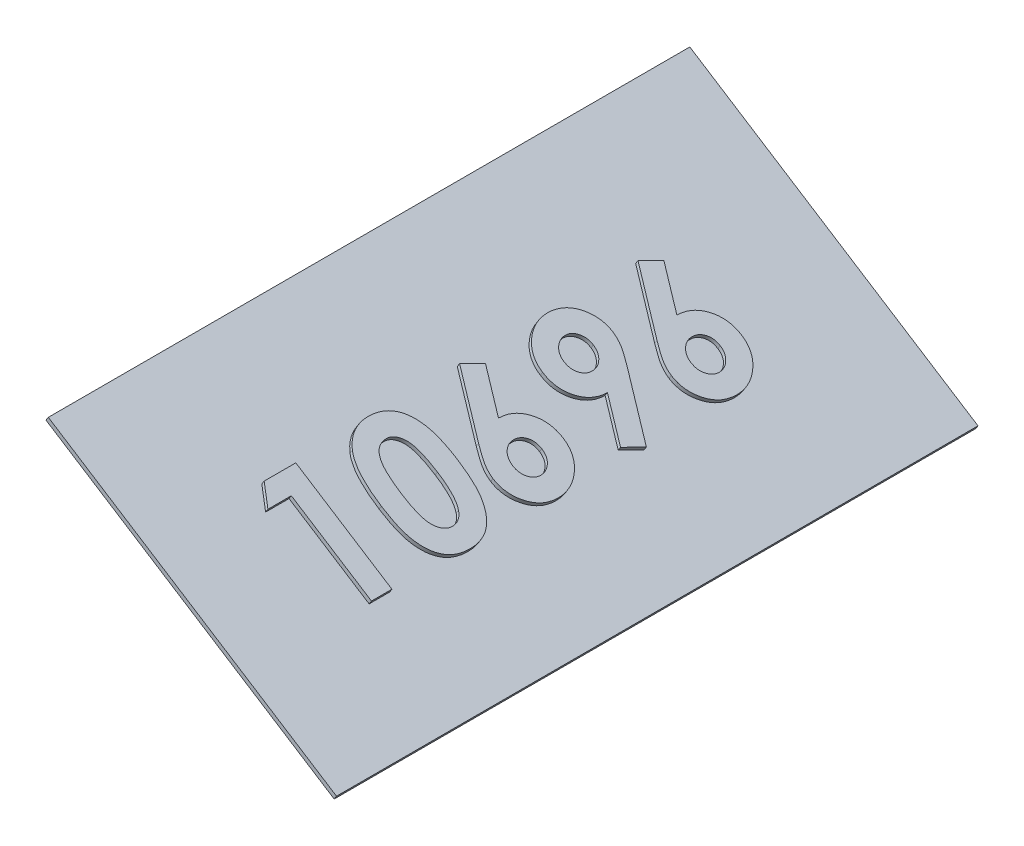
from build123d import *

# Parameters (mm, degrees)
EXTRUDE_THIN1_DEPTH = 372
BOSS_EXTRUDE1_DEPTH = 2.5


with BuildPart() as part:
    # Sketch1 → Extrude-Thin1 (new body)
    with BuildSketch(Plane.XY):
        Polygon((-701.811312748, 261.58386132), (-534.692998821, 154.86512132), (-536.038512725, 152.758087307), (-703.156826652, 259.476827307), align=None)
    extrude(amount=EXTRUDE_THIN1_DEPTH)

    # Sketch3 → Boss-Extrude1 (add)
    # profile 1 of 5: a face of its own
    with BuildSketch(Plane(origin=(-84.634070268, -132.534390154, 0), x_dir=(0.8428136053453406, -0.5382055616999779, 0), z_dir=(0.5382055616999778, 0.8428136053453404, 0))):
        Polygon((-663.215230738, -306.397431724), (-663.215230738, -288.045673077), (-597.069397405, -288.045673077), (-597.069397405, -299.918002137), (-652.190925183, -299.918002137), (-652.190925183, -313.486378205), align=None)
    # profile 2 of 5: a face of its own
    with BuildSketch(Plane(origin=(-84.634070268, -132.534390154, 0), x_dir=(0.8428136053453406, -0.5382055616999779, 0), z_dir=(0.5382055616999778, 0.8428136053453404, 0))):
        with BuildLine():
            add(Edge.make_bspline(
                [(-664.911277747, -244.571218116), (-664.902748365, -243.996547211), (-664.88597732, -242.866590672), (-664.70427082, -241.202392858), (-664.429892355, -239.599250826), (-664.046771665, -238.051169853), (-663.541371368, -236.56828686), (-662.931362489, -235.145414295), (-662.210987341, -233.78383582), (-661.376933891, -232.482109266), (-660.416323931, -231.251861537), (-659.357193197, -230.073201328), (-658.15860971, -228.993387853), (-656.851592315, -227.979792273), (-655.428326544, -227.039337076), (-653.89295764, -226.165948711), (-652.236009649, -225.368333503), (-650.455047475, -224.636978243), (-648.5232169, -223.983031552), (-646.418404739, -223.432203708), (-644.140116953, -222.959779465), (-641.682686494, -222.561019248), (-639.042845677, -222.259621199), (-636.222348628, -222.056472785), (-633.226632748, -221.917062746), (-631.171596273, -221.905685069), (-630.115813337, -221.899839744)],
                knots=[0, 0, 0, 0, 0.879187688, 1.728717895, 2.558878706, 3.367146394, 4.166631857, 4.95393622, 5.734098362, 6.521634849, 7.316678452, 8.120609651, 8.943639266, 9.781961388, 10.650008082, 11.55217958, 12.483362701, 13.462505087, 14.497127373, 15.602264045, 16.790140859, 18.057036744, 19.411188506, 20.855078804, 22.384284574, 24, 24, 24, 24], degree=3))
            add(Edge.make_bspline(
                [(-630.115813337, -221.899839744), (-629.046821661, -221.906158), (-626.969790011, -221.91843426), (-623.946669811, -222.050666324), (-621.105708074, -222.278449982), (-618.447119957, -222.571802406), (-615.972576357, -222.974411837), (-613.67894631, -223.442487896), (-611.565796799, -224.007025861), (-609.632955079, -224.678741581), (-607.847153607, -225.411222638), (-606.186864008, -226.198327844), (-604.66440446, -227.074191015), (-603.231557041, -227.958988463), (-601.950962067, -228.951447954), (-600.7722328, -229.978080032), (-599.740479912, -231.091059655), (-598.801715226, -232.242221704), (-597.99047251, -233.474077601), (-597.28096274, -234.773835472), (-596.705468674, -236.1646913), (-596.204933913, -237.621285788), (-595.845604146, -239.168448646), (-595.56048773, -240.781595182), (-595.402914922, -242.478937631), (-595.383366977, -243.63455673), (-595.373350397, -244.226708567)],
                knots=[0, 0, 0, 0, 1.643824397, 3.193921316, 4.652018541, 6.026147715, 7.305813021, 8.506024873, 9.624771103, 10.66654028, 11.650369642, 12.592128821, 13.489360096, 14.35046321, 15.179132238, 15.977837183, 16.751455772, 17.509897991, 18.259653136, 19.016390304, 19.783391144, 20.571659993, 21.382176161, 22.223003704, 23.089447706, 24, 24, 24, 24], degree=3))
            add(Edge.make_bspline(
                [(-595.373350397, -244.226708567), (-595.383562209, -244.818843354), (-595.403567, -245.978826693), (-595.559293698, -247.680773931), (-595.846838882, -249.302415338), (-596.207406269, -250.862012252), (-596.705400605, -252.347569092), (-597.294078827, -253.772273403), (-598.018027657, -255.107952826), (-598.827671296, -256.382129105), (-599.760737791, -257.574678503), (-600.802566415, -258.703279041), (-601.938553368, -259.783717676), (-603.208172035, -260.777501823), (-604.588230511, -261.702405932), (-606.07853759, -262.568245607), (-607.683964746, -263.357433788), (-609.404078022, -264.096363488), (-611.280151242, -264.750111228), (-613.329825115, -265.313842287), (-615.56844942, -265.791327016), (-617.99378394, -266.166606869), (-620.606151299, -266.469236655), (-623.403455494, -266.693661005), (-626.386729513, -266.826699048), (-628.43729374, -266.838836426), (-629.493046076, -266.84508547)],
                knots=[0, 0, 0, 0, 0.917318694, 1.797013832, 2.644089644, 3.467281984, 4.274391433, 5.068665368, 5.852346333, 6.624865025, 7.405043053, 8.194438745, 9.002823433, 9.831034161, 10.688848002, 11.574933485, 12.499091769, 13.45866927, 14.473616003, 15.574277631, 16.749933499, 18.017757418, 19.374908438, 20.82337846, 22.364486432, 24, 24, 24, 24], degree=3))
            add(Edge.make_bspline(
                [(-629.493046076, -266.84508547), (-630.959929438, -266.83375832), (-633.79029978, -266.811902439), (-637.879361997, -266.534928662), (-641.658991687, -266.128401405), (-645.122866462, -265.531309164), (-648.283815504, -264.793012865), (-651.121016135, -263.84758601), (-653.67372739, -262.771286311), (-655.185968905, -261.854140693), (-655.914278381, -261.412434896)],
                knots=[0, 0, 0, 0, 1.288568992, 2.486310467, 3.599230591, 4.627010532, 5.572937695, 6.447898582, 7.252493626, 8, 8, 8, 8], degree=3))
            add(Edge.make_bspline(
                [(-655.914278381, -261.412434896), (-656.629769384, -260.898840434), (-658.02869528, -259.894662057), (-659.865223488, -258.138828097), (-661.435912343, -256.252413112), (-662.705215749, -254.196671216), (-663.706188518, -252.004114822), (-664.413164312, -249.655919719), (-664.825081352, -247.160757398), (-664.882116556, -245.447287811), (-664.911277747, -244.571218116)],
                knots=[0, 0, 0, 0, 1.058512271, 2.069600068, 3.047294572, 4.004278952, 4.967380941, 5.939006123, 6.946246673, 8, 8, 8, 8], degree=3))
        make_face()
        with BuildLine():
            add(Edge.make_bspline(
                [(-653.038948687, -244.279710036), (-653.014249712, -244.799163217), (-652.96582661, -245.817567195), (-652.557118328, -247.296234851), (-651.921068817, -248.684541461), (-651.174873535, -249.752303329), (-650.444456278, -250.542456916), (-649.784142299, -251.097117449), (-649.046726388, -251.631774856), (-648.199328649, -252.103447598), (-647.269926936, -252.553363571), (-646.255843965, -252.979464236), (-645.140563224, -253.345854546), (-643.931592925, -253.695298374), (-642.599661709, -253.997522814), (-641.131901913, -254.261967434), (-639.523302307, -254.487248474), (-637.767120409, -254.649725215), (-635.872558685, -254.798908095), (-633.831447329, -254.906324771), (-631.644215151, -254.951133866), (-630.137906044, -254.965396083), (-629.360542404, -254.97275641)],
                knots=[0, 0, 0, 0, 1.076486532, 2.110485037, 3.16053299, 4.233735637, 4.798028448, 5.389657808, 6.0205397, 6.6857231, 7.399126456, 8.163539924, 8.966557062, 9.834164971, 10.774831688, 11.799768806, 12.928987201, 14.14492726, 15.459726247, 16.873396567, 18.386448164, 20, 20, 20, 20], degree=3))
            add(Edge.make_bspline(
                [(-629.360542404, -254.97275641), (-628.353435204, -254.960612094), (-626.422232478, -254.937324467), (-623.6450072, -254.816166556), (-621.113463292, -254.570442601), (-618.817805056, -254.271981866), (-616.771416246, -253.840961519), (-614.956118506, -253.353190545), (-613.388196963, -252.747860941), (-612.048834327, -252.048625244), (-610.90945311, -251.274116156), (-609.940971173, -250.433369577), (-609.102312188, -249.554990144), (-608.42107967, -248.61156563), (-607.899014509, -247.605345568), (-607.523499476, -246.544730349), (-607.293631089, -245.429045889), (-607.261755733, -244.665036674), (-607.245679456, -244.279710036)],
                knots=[0, 0, 0, 0, 1.771738815, 3.39744054, 4.888007323, 6.245018868, 7.467093912, 8.564230264, 9.548241846, 10.417081984, 11.216594933, 11.965786359, 12.669352538, 13.348558586, 14.005353126, 14.656563323, 15.322440191, 16, 16, 16, 16], degree=3))
            add(Edge.make_bspline(
                [(-607.245679456, -244.279710036), (-607.256680039, -243.907606587), (-607.278217813, -243.179074302), (-607.499300164, -242.116711071), (-607.858732048, -241.112064912), (-608.367173683, -240.168169165), (-609.013735015, -239.281647645), (-609.801257309, -238.456833125), (-610.737590329, -237.69994619), (-611.432487908, -237.258980426), (-611.790555425, -237.031759148)],
                knots=[0, 0, 0, 0, 0.992283464, 1.942767638, 2.88273346, 3.832339453, 4.79467288, 5.803907806, 6.868395428, 8, 8, 8, 8], degree=3))
            add(Edge.make_bspline(
                [(-611.790555425, -237.031759148), (-612.279843242, -236.764244361), (-613.305840115, -236.203287548), (-615.037171582, -235.554147356), (-616.989827328, -235.007737322), (-619.169884202, -234.537450196), (-621.585940617, -234.21580249), (-624.222676151, -233.938799878), (-627.093368337, -233.805194634), (-629.08219424, -233.783463014), (-630.115813337, -233.772168803)],
                knots=[0, 0, 0, 0, 0.710965849, 1.490837728, 2.352621235, 3.297892224, 4.334225155, 5.461620853, 6.680770821, 8, 8, 8, 8], degree=3))
            add(Edge.make_bspline(
                [(-630.115813337, -233.772168803), (-631.158404747, -233.776531513), (-633.165215231, -233.784928984), (-636.046227758, -233.938998258), (-638.677554554, -234.153551494), (-641.053320937, -234.467380941), (-643.179294229, -234.871179565), (-645.055335451, -235.368862894), (-646.68514192, -235.955594517), (-648.067088495, -236.651388298), (-649.241553512, -237.422023143), (-650.249153397, -238.240075555), (-651.109416757, -239.109004594), (-651.825580915, -240.027357128), (-652.372784045, -241.016388745), (-652.759154723, -242.057207656), (-652.992896025, -243.151947615), (-653.023390602, -243.898715251), (-653.038948687, -244.279710036)],
                knots=[0, 0, 0, 0, 1.793836731, 3.452829483, 4.963243077, 6.335886805, 7.574563692, 8.684454726, 9.672768357, 10.54971625, 11.340229787, 12.085688095, 12.778991901, 13.440269426, 14.083255152, 14.715733572, 15.344777694, 16, 16, 16, 16], degree=3))
        make_face(mode=Mode.SUBTRACT)
    # profile 3 of 5: a face of its own
    with BuildSketch(Plane(origin=(-84.634070268, -132.534390154, 0), x_dir=(0.8428136053453406, -0.5382055616999779, 0), z_dir=(0.5382055616999778, 0.8428136053453404, 0))):
        with BuildLine():
            Line((-664.911277747, -191.636000935), (-659.584630111, -181.128459702))
            Line((-659.584630111, -181.128459702), (-636.926502106, -192.656279213))
            add(Edge.make_bspline(
                [(-636.926502106, -192.656279213), (-636.90899777, -191.975176517), (-636.874520111, -190.633633058), (-636.591979476, -188.660684582), (-636.113134296, -186.769719181), (-635.444879546, -184.960815043), (-634.605324979, -183.22105331), (-633.572098428, -181.558879745), (-632.320691201, -179.996426359), (-630.931644194, -178.504543729), (-629.393486626, -177.147703715), (-627.74050166, -175.969120708), (-626.01312721, -174.941987372), (-624.172659329, -174.143539864), (-622.249621218, -173.499484243), (-620.236321521, -173.034770089), (-618.126931298, -172.769637587), (-616.693926924, -172.733084656), (-615.96442111, -172.714476496)],
                knots=[0, 0, 0, 0, 1.013301021, 1.995862538, 2.958769729, 3.911210226, 4.860765807, 5.829243184, 6.816804824, 7.835209597, 8.859810738, 9.863084768, 10.852896952, 11.844649668, 12.842374562, 13.8676291, 14.914464604, 16, 16, 16, 16], degree=3))
            add(Edge.make_bspline(
                [(-615.96442111, -172.714476496), (-615.261241753, -172.731967151), (-613.871357701, -172.766538676), (-611.829625069, -173.050679424), (-609.867969891, -173.514879357), (-607.992186941, -174.163311913), (-606.202404631, -175.010381362), (-604.488867976, -176.028497823), (-602.864869656, -177.247088854), (-601.34051113, -178.628209633), (-599.95115564, -180.138294253), (-598.716187287, -181.729932903), (-597.696063487, -183.416700857), (-596.834543195, -185.166693602), (-596.191662868, -187.012135508), (-595.70639947, -188.925407883), (-595.42638145, -190.921020046), (-595.391168864, -192.275590436), (-595.373350397, -192.96103766)],
                knots=[0, 0, 0, 0, 1.049918105, 2.075237872, 3.072085611, 4.056810501, 5.033614955, 6.024683311, 7.028730171, 8.060902963, 9.092654048, 10.090156417, 11.064284078, 12.032024683, 12.998077465, 13.977262554, 14.976443176, 16, 16, 16, 16], degree=3))
            add(Edge.make_bspline(
                [(-595.373350397, -192.96103766), (-595.388103339, -193.677756426), (-595.417113004, -195.087086903), (-595.737221054, -197.150158647), (-596.228329814, -199.124017644), (-596.895339909, -201.016705412), (-597.800669146, -202.804646068), (-598.885498671, -204.503098309), (-600.174824684, -206.105278324), (-601.630039316, -207.600747804), (-603.224713251, -208.947779991), (-604.880224736, -210.149292693), (-606.599385668, -211.165756005), (-608.380302709, -211.988563851), (-610.217315176, -212.630536472), (-612.113905818, -213.077218759), (-614.065044922, -213.368273422), (-615.389198293, -213.402392946), (-616.057173681, -213.419604701)],
                knots=[0, 0, 0, 0, 1.063729824, 2.091680771, 3.092458079, 4.082252707, 5.065066109, 6.062289472, 7.070414589, 8.114214813, 9.156632944, 10.167081891, 11.149282074, 12.117871028, 13.076366051, 14.034232288, 15.008359245, 16, 16, 16, 16], degree=3))
            add(Edge.make_bspline(
                [(-616.057173681, -213.419604701), (-616.574442614, -213.410510672), (-617.611859813, -213.392271994), (-619.165333229, -213.208972752), (-620.722894391, -212.930319953), (-622.037181339, -212.607241476), (-623.148628598, -212.274770121), (-624.088946589, -211.939469834), (-625.129935017, -211.528446602), (-626.275374613, -211.044065964), (-627.534288882, -210.506416998), (-628.891914481, -209.881409526), (-630.359080104, -209.189397351), (-631.366445645, -208.695056953), (-631.891362549, -208.437466613)],
                knots=[0, 0, 0, 0, 1.110459156, 2.227099586, 3.354645278, 4.50724841, 5.131424341, 5.845429508, 6.650417918, 7.534765369, 8.5162346, 9.590157747, 10.744282107, 12, 12, 12, 12], degree=3))
            Line((-631.891362549, -208.437466613), (-664.911277747, -191.636000935))
        make_face()
        with BuildLine():
            add(Edge.make_bspline(
                [(-625.90219655, -193.226045005), (-625.876013986, -193.795668246), (-625.824778144, -194.910346155), (-625.29004875, -196.496052943), (-624.448641238, -197.936093567), (-623.292997455, -199.197386112), (-621.89148727, -200.244585931), (-620.289764156, -201.00815913), (-618.516877971, -201.474853465), (-617.279142214, -201.522618203), (-616.64018984, -201.547275641)],
                knots=[0, 0, 0, 0, 0.981531227, 1.92072777, 2.858278205, 3.847411092, 4.856727683, 5.864107753, 6.897395173, 8, 8, 8, 8], degree=3))
            add(Edge.make_bspline(
                [(-616.64018984, -201.547275641), (-616.001177591, -201.517683132), (-614.758256052, -201.460123724), (-612.974150192, -200.983084778), (-611.350363618, -200.189741717), (-609.937140439, -199.085711149), (-608.746932153, -197.798752926), (-607.878610837, -196.357109377), (-607.343652683, -194.804069752), (-607.278562701, -193.729276113), (-607.245679456, -193.186293904)],
                knots=[0, 0, 0, 0, 1.098517379, 2.136689732, 3.153260427, 4.188757218, 5.205896274, 6.153740673, 7.067275863, 8, 8, 8, 8], degree=3))
            add(Edge.make_bspline(
                [(-607.245679456, -193.186293904), (-607.279198621, -192.612891015), (-607.344935525, -191.48834836), (-607.856683492, -189.866072312), (-608.71182382, -188.384312368), (-609.883675991, -187.073368435), (-611.282113574, -185.952788674), (-612.918048083, -185.1635959), (-614.721057966, -184.669081823), (-615.987592356, -184.614783458), (-616.64018984, -184.586805556)],
                knots=[0, 0, 0, 0, 0.969156912, 1.90068503, 2.84824055, 3.843957741, 4.860802806, 5.860356532, 6.897522282, 8, 8, 8, 8], degree=3))
            add(Edge.make_bspline(
                [(-616.64018984, -184.586805556), (-617.278774031, -184.61767651), (-618.51546688, -184.677461719), (-620.296560452, -185.132809619), (-621.892298561, -185.932980924), (-623.298859512, -187.004025487), (-624.453729459, -188.3083657), (-625.29671346, -189.806231453), (-625.823817718, -191.464368591), (-625.87568935, -192.630257748), (-625.90219655, -193.226045005)],
                knots=[0, 0, 0, 0, 1.082993585, 2.097343529, 3.092828129, 4.092676255, 5.080456977, 6.026823306, 6.991676418, 8, 8, 8, 8], degree=3))
        make_face(mode=Mode.SUBTRACT)
    # profile 4 of 5: a face of its own
    with BuildSketch(Plane(origin=(-84.634070268, -132.534390154, 0), x_dir=(0.8428136053453406, -0.5382055616999779, 0), z_dir=(0.5382055616999778, 0.8428136053453404, 0))):
        with BuildLine():
            Line((-595.373350397, -141.920622997), (-600.673497298, -152.441414597))
            Line((-600.673497298, -152.441414597), (-623.358126038, -140.913595085))
            add(Edge.make_bspline(
                [(-623.358126038, -140.913595085), (-623.37548743, -141.594684083), (-623.409572042, -142.931826573), (-623.692774765, -144.900682428), (-624.176321053, -146.783382704), (-624.819695733, -148.60244618), (-625.683505021, -150.331498892), (-626.711055896, -151.99846075), (-627.964478975, -153.559806104), (-629.352331505, -155.052928325), (-630.890491505, -156.403571772), (-632.533987495, -157.5964159), (-634.267001205, -158.606469121), (-636.101178172, -159.417297368), (-638.018239327, -160.054125328), (-640.025704803, -160.523820639), (-642.131296179, -160.786609451), (-643.564234242, -160.823412133), (-644.293706299, -160.842147436)],
                knots=[0, 0, 0, 0, 1.014438208, 1.991587644, 2.955575466, 3.906834206, 4.860343588, 5.829907848, 6.818577787, 7.838125475, 8.863876483, 9.862937823, 10.859547262, 11.846397878, 12.845242478, 13.865236027, 14.913246352, 16, 16, 16, 16], degree=3))
            add(Edge.make_bspline(
                [(-644.293706299, -160.842147436), (-645.001305049, -160.824804666), (-646.395613745, -160.790631095), (-648.441844547, -160.506255589), (-650.407143422, -160.039637068), (-652.292051584, -159.393309327), (-654.086971132, -158.551644574), (-655.802597177, -157.534752453), (-657.432367657, -156.327485019), (-658.9550435, -154.939754221), (-660.354465452, -153.436172952), (-661.558898488, -151.818591468), (-662.610130798, -150.149245766), (-663.440687741, -148.382216426), (-664.115728289, -146.55033197), (-664.572193075, -144.628401818), (-664.859850884, -142.636061704), (-664.893998288, -141.281187323), (-664.911277747, -140.595586271)],
                knots=[0, 0, 0, 0, 1.055350394, 2.079546115, 3.075301024, 4.065173222, 5.046874257, 6.027823047, 7.036058964, 8.067100199, 9.097720188, 10.095392023, 11.071904115, 12.035727154, 13.002945728, 13.979480054, 14.977565287, 16, 16, 16, 16], degree=3))
            add(Edge.make_bspline(
                [(-664.911277747, -140.595586271), (-664.896518859, -139.878871294), (-664.867497503, -138.469548265), (-664.547474131, -136.406422572), (-664.056055189, -134.432761198), (-663.390183068, -132.539348401), (-662.481702676, -130.756220903), (-661.414455014, -129.049402747), (-660.122058894, -127.45197296), (-658.668093448, -125.95574153), (-657.073158732, -124.608746938), (-655.417444521, -123.407825055), (-653.695849381, -122.387002865), (-651.907174437, -121.57157219), (-650.063709847, -120.92319535), (-648.161377536, -120.481406183), (-646.202047458, -120.187329313), (-644.873389216, -120.153925128), (-644.200953729, -120.137019231)],
                knots=[0, 0, 0, 0, 1.062709067, 2.08967359, 3.089490552, 4.078335371, 5.060205664, 6.052952122, 7.060109841, 8.102908433, 9.144326257, 10.153805576, 11.135063239, 12.108674621, 13.066249871, 14.029571809, 15.002763993, 16, 16, 16, 16], degree=3))
            add(Edge.make_bspline(
                [(-644.200953729, -120.137019231), (-643.688114622, -120.14630423), (-642.655141357, -120.165006306), (-641.110302534, -120.34660387), (-639.561494442, -120.625919303), (-638.256917581, -120.951663303), (-637.152779021, -121.279318939), (-636.21875773, -121.620026027), (-635.17796124, -122.030934721), (-634.028787822, -122.506538122), (-632.77693036, -123.050657312), (-631.426739356, -123.681839323), (-629.957525588, -124.360218438), (-628.952926709, -124.860333034), (-628.433016696, -125.119157318)],
                knots=[0, 0, 0, 0, 1.105166677, 2.22605417, 3.348517788, 4.496260522, 5.122810462, 5.830557215, 6.638607343, 7.535109037, 8.511576286, 9.580928918, 10.748058253, 12, 12, 12, 12], degree=3))
            Line((-628.433016696, -125.119157318), (-595.373350397, -141.920622997))
        make_face()
        with BuildLine():
            add(Edge.make_bspline(
                [(-634.382431593, -140.330578926), (-634.41586944, -139.761658946), (-634.481199423, -138.650118117), (-634.987905362, -137.05426832), (-635.852370676, -135.620314279), (-637.016867925, -134.362483973), (-638.416813717, -133.315394068), (-640.007408375, -132.548141724), (-641.763320347, -132.082973559), (-642.987856804, -132.034361466), (-643.617937569, -132.009348291)],
                knots=[0, 0, 0, 0, 0.984989413, 1.924446292, 2.868477643, 3.865502828, 4.877610339, 5.88087679, 6.909612885, 8, 8, 8, 8], degree=3))
            add(Edge.make_bspline(
                [(-643.617937569, -132.009348291), (-644.261201602, -132.03925794), (-645.512503731, -132.09743935), (-647.31347857, -132.570611231), (-648.941453011, -133.379166799), (-650.35661113, -134.479160401), (-651.540917685, -135.763388586), (-652.406021731, -137.199479856), (-652.940974345, -138.75256293), (-653.006065068, -139.827350755), (-653.038948687, -140.370330028)],
                knots=[0, 0, 0, 0, 1.104110315, 2.147758178, 3.172670271, 4.206310416, 5.210906102, 6.157051016, 7.068948237, 8, 8, 8, 8], degree=3))
            add(Edge.make_bspline(
                [(-653.038948687, -140.370330028), (-653.006827674, -140.944168085), (-652.943758327, -142.070894412), (-652.411007022, -143.68811628), (-651.560409101, -145.172188927), (-650.386667396, -146.487843146), (-648.977394626, -147.600084419), (-647.344210275, -148.390946115), (-645.554866828, -148.886644095), (-644.301452135, -148.94159511), (-643.657688671, -148.969818376)],
                knots=[0, 0, 0, 0, 0.970853505, 1.906262912, 2.855477211, 3.852937491, 4.877462982, 5.878766514, 6.910518104, 8, 8, 8, 8], degree=3))
            add(Edge.make_bspline(
                [(-643.657688671, -148.969818376), (-643.022968942, -148.940499732), (-641.788505346, -148.88347803), (-640.02068923, -148.403186807), (-638.414441161, -147.628217614), (-637.012561374, -146.547264786), (-635.842138721, -145.247353145), (-634.987721868, -143.748954835), (-634.479783697, -142.085161499), (-634.415466444, -140.925967938), (-634.382431593, -140.330578926)],
                knots=[0, 0, 0, 0, 1.075841396, 2.092399178, 3.084869331, 4.085011737, 5.078048045, 6.03490933, 6.990683323, 8, 8, 8, 8], degree=3))
        make_face(mode=Mode.SUBTRACT)
    # profile 5 of 5: a face of its own
    with BuildSketch(Plane(origin=(-84.634070268, -132.534390154, 0), x_dir=(0.8428136053453406, -0.5382055616999779, 0), z_dir=(0.5382055616999778, 0.8428136053453404, 0))):
        with BuildLine():
            Line((-664.911277747, -88.177133413), (-659.584630111, -77.669592181))
            Line((-659.584630111, -77.669592181), (-636.926502106, -89.197411692))
            add(Edge.make_bspline(
                [(-636.926502106, -89.197411692), (-636.90899777, -88.516308995), (-636.874520111, -87.174765536), (-636.591979476, -85.20181706), (-636.113134296, -83.31085166), (-635.444879546, -81.501947522), (-634.605324979, -79.762185789), (-633.572098428, -78.100012224), (-632.320691201, -76.537558837), (-630.931644194, -75.045676208), (-629.393486626, -73.688836194), (-627.74050166, -72.510253187), (-626.01312721, -71.483119851), (-624.172659329, -70.684672342), (-622.249621218, -70.040616721), (-620.236321521, -69.575902568), (-618.126931298, -69.310770066), (-616.693926924, -69.274217135), (-615.96442111, -69.255608974)],
                knots=[0, 0, 0, 0, 1.013301021, 1.995862538, 2.958769729, 3.911210226, 4.860765807, 5.829243184, 6.816804824, 7.835209597, 8.859810738, 9.863084768, 10.852896952, 11.844649668, 12.842374562, 13.8676291, 14.914464604, 16, 16, 16, 16], degree=3))
            add(Edge.make_bspline(
                [(-615.96442111, -69.255608974), (-615.261241753, -69.27309963), (-613.871357701, -69.307671154), (-611.829625069, -69.591811903), (-609.867969891, -70.056011836), (-607.992186941, -70.704444392), (-606.202404631, -71.55151384), (-604.488867976, -72.569630302), (-602.864869656, -73.788221333), (-601.34051113, -75.169342112), (-599.95115564, -76.679426732), (-598.716187287, -78.271065382), (-597.696063487, -79.957833335), (-596.834543195, -81.70782608), (-596.191662868, -83.553267986), (-595.70639947, -85.466540361), (-595.42638145, -87.462152524), (-595.391168864, -88.816722915), (-595.373350397, -89.502170139)],
                knots=[0, 0, 0, 0, 1.049918105, 2.075237872, 3.072085611, 4.056810501, 5.033614955, 6.024683311, 7.028730171, 8.060902963, 9.092654048, 10.090156417, 11.064284078, 12.032024683, 12.998077465, 13.977262554, 14.976443176, 16, 16, 16, 16], degree=3))
            add(Edge.make_bspline(
                [(-595.373350397, -89.502170139), (-595.388103339, -90.218888905), (-595.417113004, -91.628219382), (-595.737221054, -93.691291125), (-596.228329814, -95.665150122), (-596.895339909, -97.557837891), (-597.800669146, -99.345778547), (-598.885498671, -101.044230787), (-600.174824684, -102.646410803), (-601.630039316, -104.141880282), (-603.224713251, -105.48891247), (-604.880224736, -106.690425172), (-606.599385668, -107.706888484), (-608.380302709, -108.52969633), (-610.217315176, -109.17166895), (-612.113905818, -109.618351238), (-614.065044922, -109.9094059), (-615.389198293, -109.943525425), (-616.057173681, -109.960737179)],
                knots=[0, 0, 0, 0, 1.063729824, 2.091680771, 3.092458079, 4.082252707, 5.065066109, 6.062289472, 7.070414589, 8.114214813, 9.156632944, 10.167081891, 11.149282074, 12.117871028, 13.076366051, 14.034232288, 15.008359245, 16, 16, 16, 16], degree=3))
            add(Edge.make_bspline(
                [(-616.057173681, -109.960737179), (-616.574442614, -109.951643151), (-617.611859813, -109.933404472), (-619.165333229, -109.750105231), (-620.722894391, -109.471452431), (-622.037181339, -109.148373955), (-623.148628598, -108.8159026), (-624.088946589, -108.480602313), (-625.129935017, -108.069579081), (-626.275374613, -107.585198443), (-627.534288882, -107.047549477), (-628.891914481, -106.422542005), (-630.359080104, -105.73052983), (-631.366445645, -105.236189431), (-631.891362549, -104.978599092)],
                knots=[0, 0, 0, 0, 1.110459156, 2.227099586, 3.354645278, 4.50724841, 5.131424341, 5.845429508, 6.650417918, 7.534765369, 8.5162346, 9.590157747, 10.744282107, 12, 12, 12, 12], degree=3))
            Line((-631.891362549, -104.978599092), (-664.911277747, -88.177133413))
        make_face()
        with BuildLine():
            add(Edge.make_bspline(
                [(-625.90219655, -89.767177484), (-625.876013986, -90.336800725), (-625.824778144, -91.451478634), (-625.29004875, -93.037185421), (-624.448641238, -94.477226045), (-623.292997455, -95.738518591), (-621.89148727, -96.78571841), (-620.289764156, -97.549291609), (-618.516877971, -98.015985944), (-617.279142214, -98.063750682), (-616.64018984, -98.08840812)],
                knots=[0, 0, 0, 0, 0.981531227, 1.92072777, 2.858278205, 3.847411092, 4.856727683, 5.864107753, 6.897395173, 8, 8, 8, 8], degree=3))
            add(Edge.make_bspline(
                [(-616.64018984, -98.08840812), (-616.001177591, -98.058815611), (-614.758256052, -98.001256202), (-612.974150192, -97.524217256), (-611.350363618, -96.730874195), (-609.937140439, -95.626843627), (-608.746932153, -94.339885404), (-607.878610837, -92.898241856), (-607.343652683, -91.345202231), (-607.278562701, -90.270408592), (-607.245679456, -89.727426382)],
                knots=[0, 0, 0, 0, 1.098517379, 2.136689732, 3.153260427, 4.188757218, 5.205896274, 6.153740673, 7.067275863, 8, 8, 8, 8], degree=3))
            add(Edge.make_bspline(
                [(-607.245679456, -89.727426382), (-607.279198621, -89.154023494), (-607.344935525, -88.029480839), (-607.856683492, -86.40720479), (-608.71182382, -84.925444847), (-609.883675991, -83.614500914), (-611.282113574, -82.493921153), (-612.918048083, -81.704728379), (-614.721057966, -81.210214302), (-615.987592356, -81.155915937), (-616.64018984, -81.127938034)],
                knots=[0, 0, 0, 0, 0.969156912, 1.90068503, 2.84824055, 3.843957741, 4.860802806, 5.860356532, 6.897522282, 8, 8, 8, 8], degree=3))
            add(Edge.make_bspline(
                [(-616.64018984, -81.127938034), (-617.278774031, -81.158808989), (-618.51546688, -81.218594197), (-620.296560452, -81.673942098), (-621.892298561, -82.474113403), (-623.298859512, -83.545157965), (-624.453729459, -84.849498178), (-625.29671346, -86.347363932), (-625.823817718, -88.00550107), (-625.87568935, -89.171390227), (-625.90219655, -89.767177484)],
                knots=[0, 0, 0, 0, 1.082993585, 2.097343529, 3.092828129, 4.092676255, 5.080456977, 6.026823306, 6.991676418, 8, 8, 8, 8], degree=3))
        make_face(mode=Mode.SUBTRACT)
    extrude(amount=BOSS_EXTRUDE1_DEPTH)


solid = part.part
